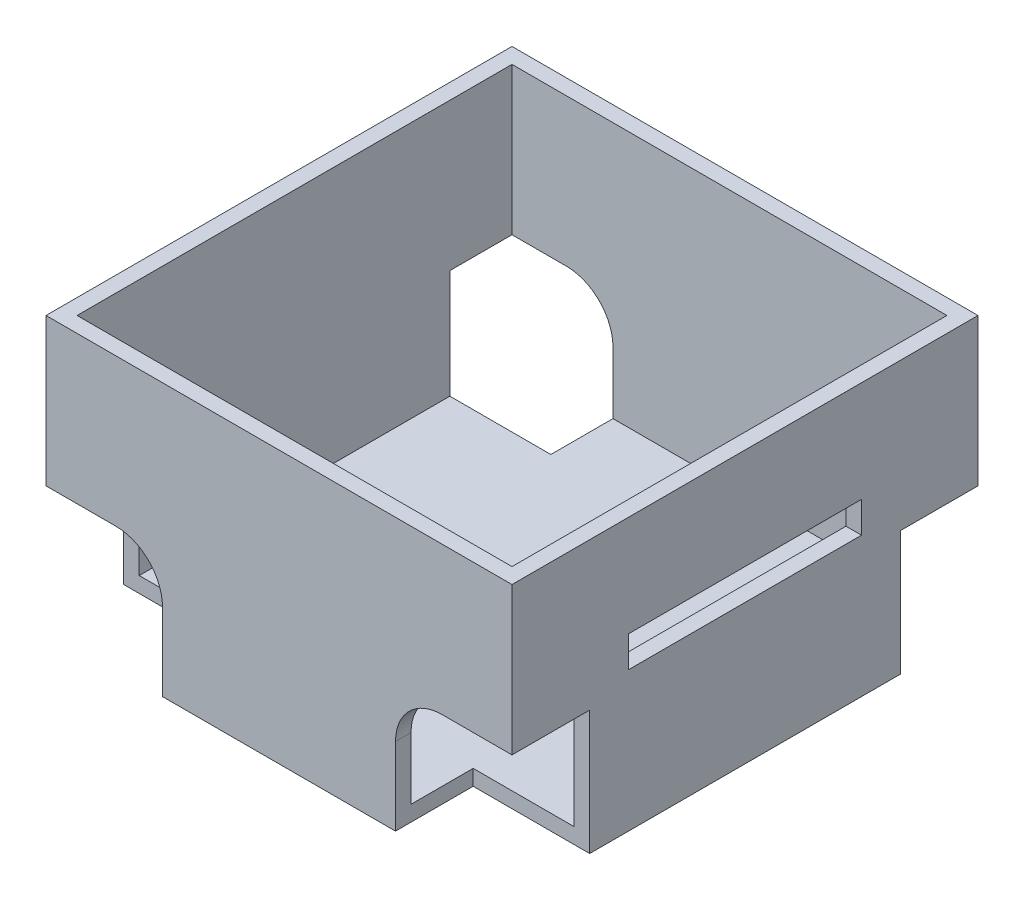
from build123d import *

# Parameters (mm, degrees)
SKETCH1_W                      = 300
SKETCH1_H                      = 300
BOSS_EXTRUDE1_DEPTH            = 175
SHELL1_T                       = -10
CUT_EXTRUDE5_DEPTH             = 50
CUT_EXTRUDE6_START             = -50
CUT_EXTRUDE6_DEPTH             = 50
CUT_EXTRUDE7_REACH             = 380.319
SKETCH8_W                      = 150
SKETCH8_H                      = 20
CUT_EXTRUDE7_DIRECTION_2_DEPTH = 379.318648761


with BuildPart() as part:
    # Sketch1 → Boss-Extrude1 (new body)
    with BuildSketch(Plane(origin=(0, 0, 0), x_dir=(1, 0, 0), z_dir=(0, 1, 0))):
        Rectangle(SKETCH1_W, SKETCH1_H)
    extrude(amount=BOSS_EXTRUDE1_DEPTH)

    # Shell1
    shell1_openings = [part.faces().sort_by_distance(p)[0] for p in [
        (0, 175, 0),
    ]]
    offset(amount=SHELL1_T, openings=shell1_openings, kind=Kind.INTERSECTION)

    # Sketch4 → Cut-Extrude5 (cut)
    with BuildSketch(Plane.XY.offset(150)):
        with BuildLine():
            Line((0, 0), (75, 0))
            Line((75, 0), (75, 50))
            ThreePointArc((75, 50), (83.786796564, 71.213203436), (105, 80))
            Line((105, 80), (150, 80))
            Line((150, 80), (150, -5))
            Line((150, -5), (-150, -5))
            Line((-150, -5), (-150, 80))
            Line((-150, 80), (-105, 80))
            ThreePointArc((-105, 80), (-83.786796564, 71.213203436), (-75, 50))
            Line((-75, 50), (-75, 0))
            Line((-75, 0), (0, 0))
        make_face()
    extrude(amount=-CUT_EXTRUDE5_DEPTH, mode=Mode.SUBTRACT)

    # Sketch7 → Cut-Extrude6 (cut)
    with BuildSketch(Plane(origin=(0, 0, -150), x_dir=(-1, 0, 0), z_dir=(0, 0, -1)).offset(CUT_EXTRUDE6_START)):
        with BuildLine():
            Line((0, 0), (75, 0))
            Line((75, 0), (75, 50))
            ThreePointArc((75, 50), (83.786796564, 71.213203436), (105, 80))
            Line((105, 80), (150, 80))
            Line((150, 80), (150, -5))
            Line((150, -5), (-150, -5))
            Line((-150, -5), (-150, 80))
            Line((-150, 80), (-105, 80))
            ThreePointArc((-105, 80), (-83.786796564, 71.213203436), (-75, 50))
            Line((-75, 50), (-75, 0))
            Line((-75, 0), (0, 0))
        make_face()
    extrude(amount=CUT_EXTRUDE6_DEPTH, mode=Mode.SUBTRACT)

    # Sketch8 → Cut-Extrude7 (cut, up to next)
    with BuildSketch(Plane(origin=(150, 0, 0), x_dir=(0, 0, -1), z_dir=(1, 0, 0)), mode=Mode.PRIVATE) as cut_extrude7_sk1:
        with Locations((0, 100)):
            Rectangle(SKETCH8_W, SKETCH8_H)
    cut_extrude7_tool1 = extrude(cut_extrude7_sk1.sketch, amount=-CUT_EXTRUDE7_REACH, mode=Mode.PRIVATE) & part.part
    add(cut_extrude7_tool1.solids().sort_by_distance((150, 100, 0))[0], mode=Mode.SUBTRACT)

    # Sketch8 → Cut-Extrude7 direction 2 (cut)
    with BuildSketch(Plane(origin=(150, 0, 0), x_dir=(0, 0, -1), z_dir=(1, 0, 0))):
        with Locations((0, 100)):
            Rectangle(SKETCH8_W, SKETCH8_H)
    extrude(amount=CUT_EXTRUDE7_DIRECTION_2_DEPTH, mode=Mode.SUBTRACT)


solid = part.part
